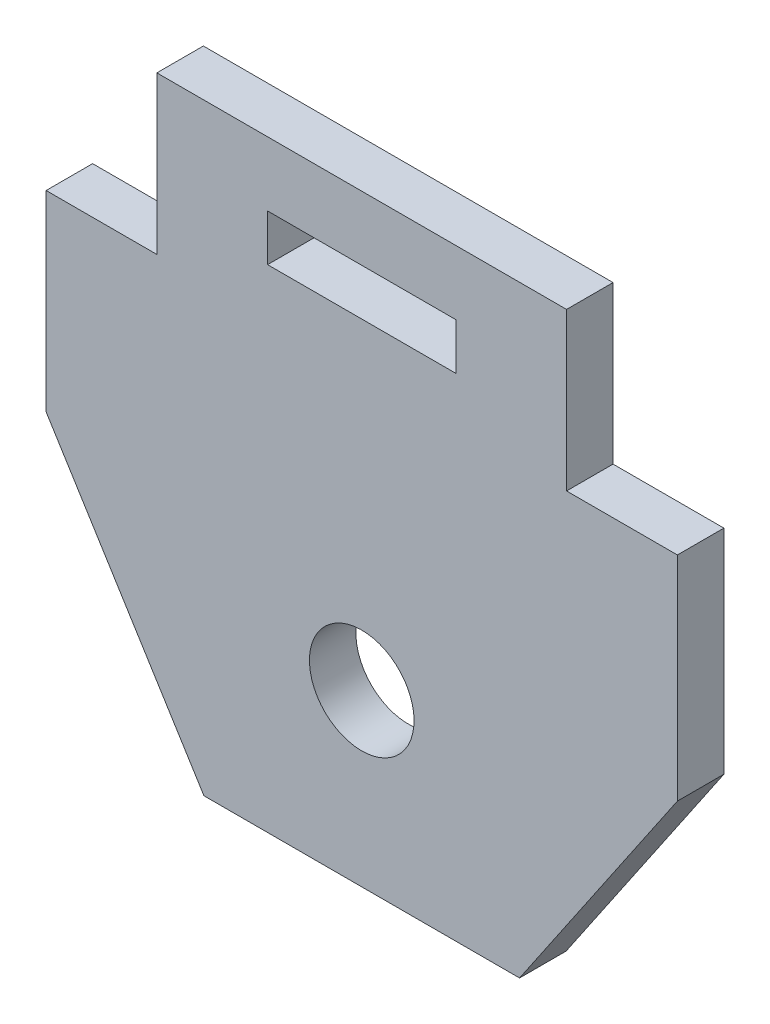
from build123d import *

# Parameters (mm, degrees)
SKETCH1_W           = 21.59
SKETCH1_H           = 5.334
BOSS_EXTRUDE1_DEPTH = 5.334
SKETCH2_R           = 6
CUT_EXTRUDE1_DEPTH  = 5.334


with BuildPart() as part:
    # Sketch1 → Boss-Extrude1 (new body)
    with BuildSketch(Plane.XY):
        Polygon((-36.2, 24.449992223), (-23.5, 24.449992223), (-23.5, 42.483992223), (23.49, 42.483992223), (23.49, 24.449992223), (36.2, 24.449992223), (36.2, -7.777e-06), (18.1, -26.619054692), (-18.1, -26.619054692), (-36.2, 2.462571049), align=None)
        with Locations((-0.005, 32.451)):
            Rectangle(SKETCH1_W, SKETCH1_H, mode=Mode.SUBTRACT)
    extrude(amount=BOSS_EXTRUDE1_DEPTH)

    # Sketch2 → Cut-Extrude1 (cut)
    with BuildSketch(Plane.XY.offset(5.334)):
        with Locations((0, -7.112000122)):
            Circle(SKETCH2_R)
    extrude(amount=-CUT_EXTRUDE1_DEPTH, mode=Mode.SUBTRACT)


solid = part.part
